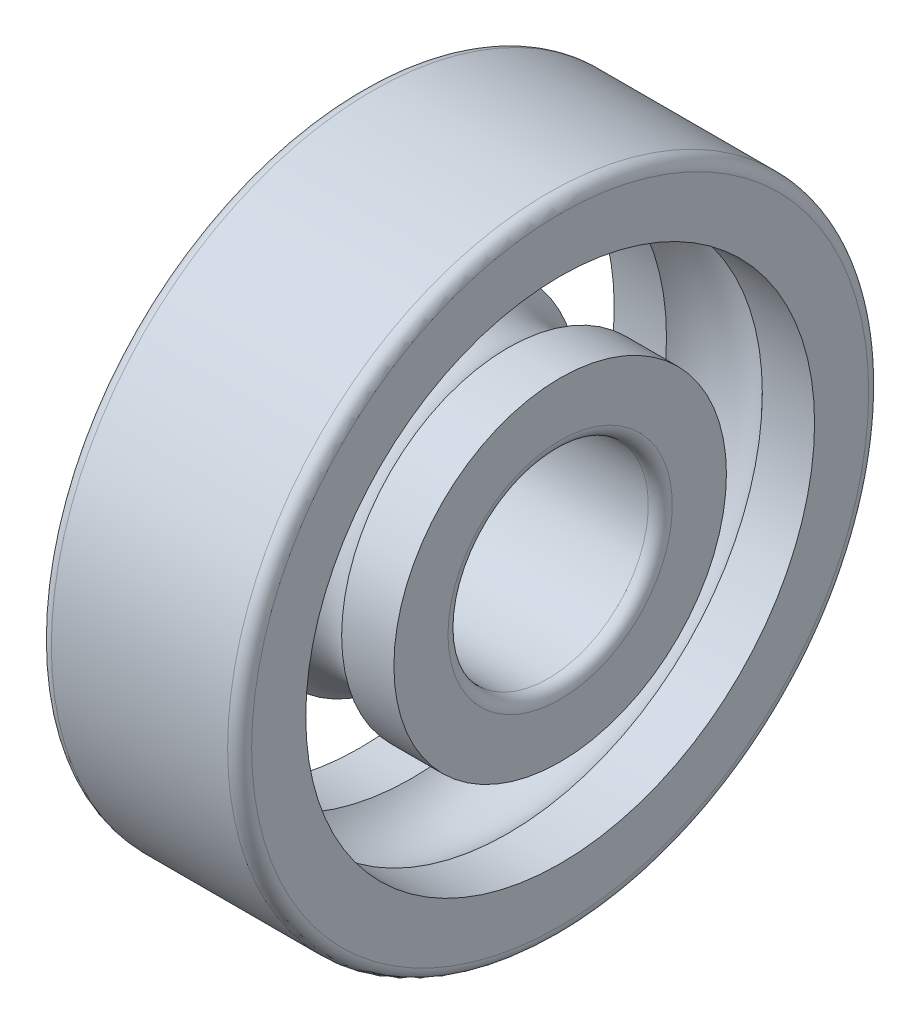
from build123d import *


with BuildPart() as part:
    # ralla → Revolve1 (revolve)
    with BuildSketch(Plane.XY, mode=Mode.PRIVATE) as revolve1_sk:
        with BuildLine():
            ThreePointArc((1.196087371, 6.35), (0, 6.875), (-1.196087371, 6.35))
            Line((-1.196087371, 6.35), (-2.5, 6.35))
            Line((-2.5, 6.35), (-2.5, 7.7))
            ThreePointArc((-2.5, 7.7), (-2.412132034, 7.912132034), (-2.2, 8))
            Line((-2.2, 8), (2.2, 8))
            ThreePointArc((2.2, 8), (2.412132034, 7.912132034), (2.5, 7.7))
            Line((2.5, 7.7), (2.5, 6.35))
            Line((2.5, 6.35), (1.196087371, 6.35))
        make_face()
        with BuildLine():
            Line((2.5, 4.15), (1.196087371, 4.15))
            ThreePointArc((1.196087371, 4.15), (0, 3.625), (-1.196087371, 4.15))
            Line((-1.196087371, 4.15), (-2.5, 4.15))
            Line((-2.5, 4.15), (-2.5, 2.8))
            ThreePointArc((-2.5, 2.8), (-2.412132034, 2.587867966), (-2.2, 2.5))
            Line((-2.2, 2.5), (2.2, 2.5))
            ThreePointArc((2.2, 2.5), (2.412132034, 2.587867966), (2.5, 2.8))
            Line((2.5, 2.8), (2.5, 4.15))
        make_face()
    revolve(revolve1_sk.sketch.rotate(Axis((-3.633751792, 0, 0), (1, 0, 0)), 90), axis=Axis((-3.633751792, 0, 0), (1, 0, 0)))


solid = part.part
